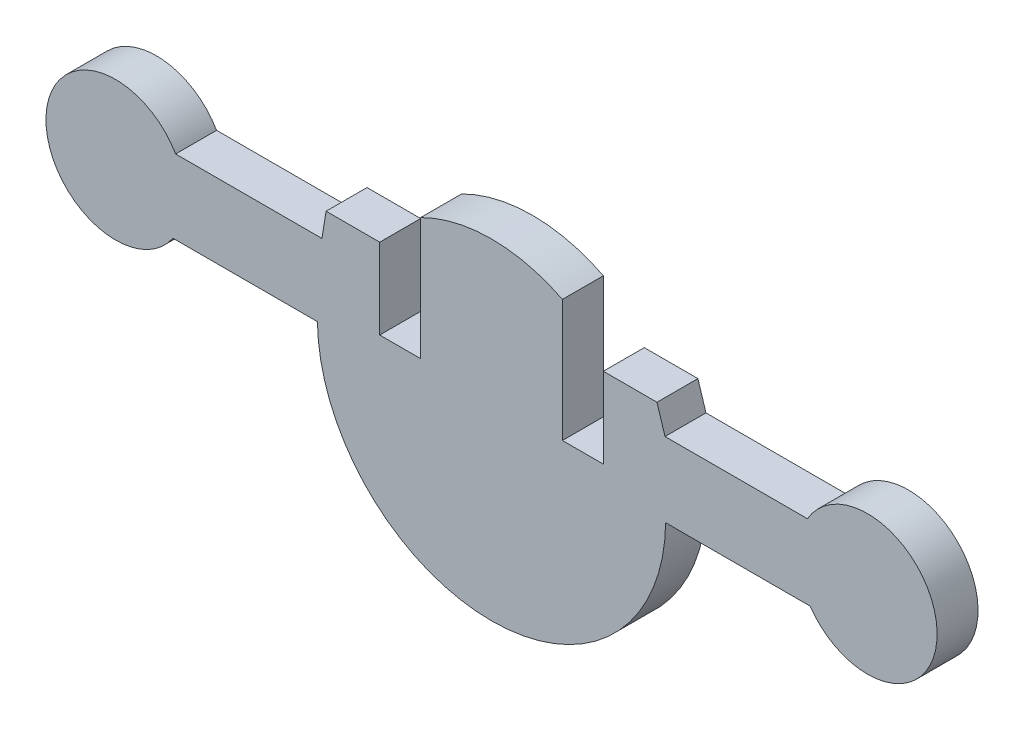
from build123d import *

# Parameters (mm, degrees)
BASE_EXTRUDE_DEPTH = 3


with BuildPart() as part:
    # Sketch1 → Base-Extrude (new body)
    with BuildSketch(Plane.XY):
        with BuildLine():
            Line((380.162891568, 81.023267436), (390.599019838, 81.023267436))
            ThreePointArc((390.599019838, 81.023267436), (400.101534094, 78.637901495), (390.795096715, 75.575554167))
            Line((390.795096715, 75.575554167), (380.207812671, 75.575554167))
            ThreePointArc((380.207812671, 75.575554167), (367.447420728, 62.962928121), (354.687028785, 75.575554167))
            Line((354.687028785, 75.575554167), (344.099744741, 75.575554167))
            ThreePointArc((344.099744741, 75.575554167), (334.793307361, 78.637901495), (344.295821617, 81.023267436))
            Line((344.295821617, 81.023267436), (355.018550657, 81.023267436))
            Line((355.018550657, 81.023267436), (355.321416521, 82.905419895))
            Line((355.321416521, 82.905419895), (359.252420728, 82.905419895))
            Line((359.252420728, 82.905419895), (359.252420728, 77.010044337))
            Line((359.252420728, 77.010044337), (362.252420728, 77.010044337))
            Line((362.252420728, 77.010044337), (362.252420728, 85.966138483))
            ThreePointArc((362.252420728, 85.966138483), (367.447420728, 87.208332237), (372.642420728, 85.966138483))
            Line((372.642420728, 85.966138483), (372.642420728, 77.010044337))
            Line((372.642420728, 77.010044337), (375.642420728, 77.010044337))
            Line((375.642420728, 77.010044337), (375.642420728, 82.905419895))
            Line((375.642420728, 82.905419895), (379.573424935, 82.905419895))
            Line((379.573424935, 82.905419895), (380.162891568, 81.023267436))
        make_face()
    extrude(amount=BASE_EXTRUDE_DEPTH)


solid = part.part
